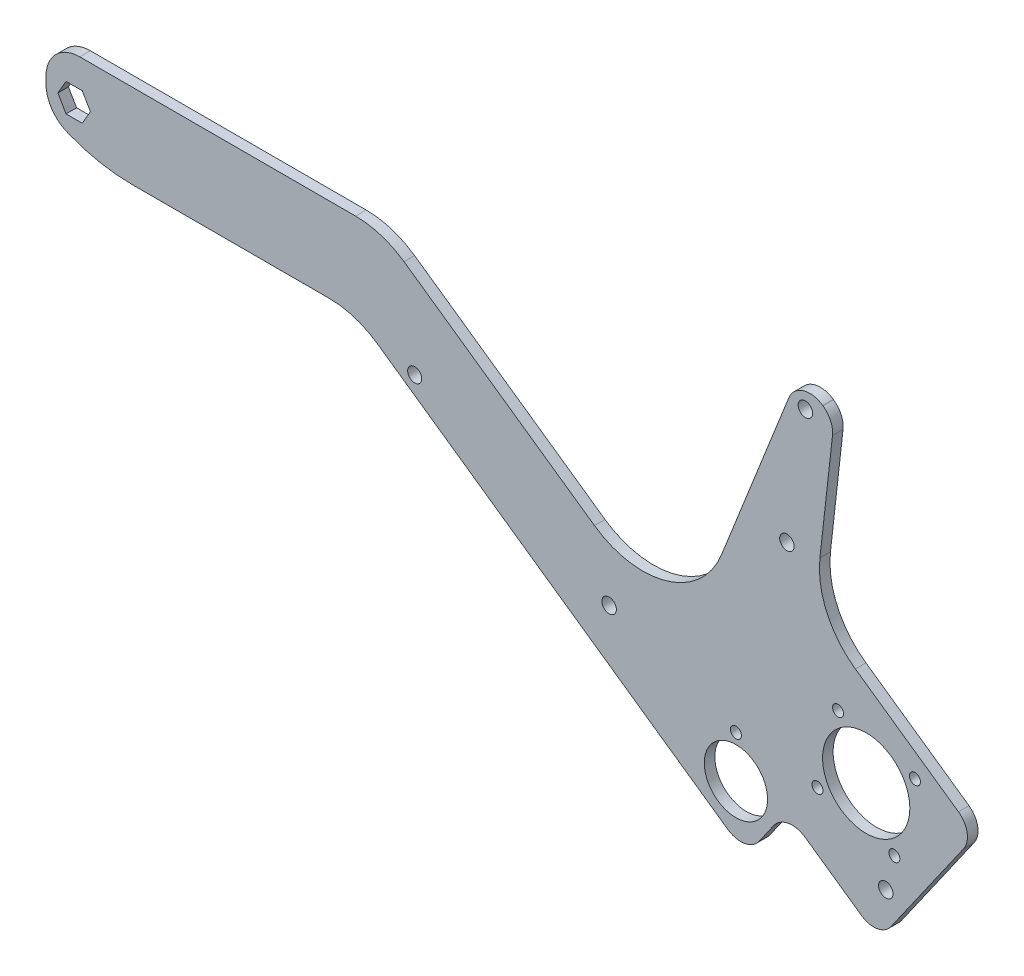
from build123d import *

# Parameters (mm, degrees)
SKETCH1_R               = 14.2875
SKETCH1_R_2             = 3.2639
SKETCH1_R_3             = 2.4892
BOSS_EXTRUDE1_DEPTH     = 4.7625
CUT_EXTRUDE1_DEPTH      = 446.923725363
CUT_EXTRUDE1_DEPTH_BACK = 446.923725363
SKETCH2_R               = 19.685
SKETCH2_R_2             = 2.4892
SKETCH2_R_3             = 3.175
FILLET3_R               = 38.1
FILLET4_R               = 10.16


with BuildPart() as part:
    # Sketch1 → Boss-Extrude1 (new body)
    with BuildSketch(Plane.XY):
        with BuildLine():
            Line((27.94, 38.1), (164.412883856, 38.1))
            Line((164.412883856, 38.1), (299.654886368, -56.597469642))
            Line((299.654886368, -56.597469642), (352.6409093, 76.843527732))
            Line((352.6409093, 76.843527732), (368.245755744, 65.91689662))
            Line((368.245755744, 65.91689662), (359.391134552, -13.154135899))
            Line((359.391134552, -13.154135899), (424.411328067, -58.681765534))
            ThreePointArc((424.411328067, -58.681765534), (428.328306358, -64.830189864), (426.750435733, -71.947504312))
            Line((426.750435733, -71.947504312), (393.970542395, -118.762043644))
            ThreePointArc((393.970542395, -118.762043644), (387.822118066, -122.679021935), (380.704803617, -121.101151309))
            Line((380.704803617, -121.101151309), (346.894302989, -97.426783899))
            Line((346.894302989, -97.426783899), (328.683251135, -123.434861305))
            Line((328.683251135, -123.434861305), (152.4, 0))
            Line((152.4, 0), (51.495079847, 0))
            ThreePointArc((51.495079847, 0), (37.452913318, 1.305023138), (23.891727162, 5.175392148))
            Line((23.891727162, 5.175392148), (22.419329463, 5.747632027))
            ThreePointArc((22.419329463, 5.747632027), (15.362388562, 11.346666629), (12.7, 19.952553597))
            Line((12.7, 19.952553597), (12.7, 22.86))
            ThreePointArc((12.7, 22.86), (17.163692655, 33.636307345), (27.94, 38.1))
        make_face()
        with Locations(Location((324.005035804, -96.903383749, 0), (0, 0, 180))):
            Circle(SKETCH1_R, mode=Mode.SUBTRACT)
        with Locations(Location((347.013016961, 7.916185169, 0), (0, 0, 180))):
            Circle(SKETCH1_R_2, mode=Mode.SUBTRACT)
        with Locations(Location((324.005035804, -77.853383749, 0), (0, 0, 180))):
            Circle(SKETCH1_R_3, mode=Mode.SUBTRACT)
        with Locations(Location((355.344238002, 64.097950502, 0), (0, 0, 180))):
            Circle(SKETCH1_R_2, mode=Mode.SUBTRACT)
        with Locations(Location((391.63143473, -105.496304865, 0), (0, 0, 180))):
            Circle(SKETCH1_R_2, mode=Mode.SUBTRACT)
        with Locations(Location((266.78726551, -56.83906967, 0), (0, 0, 180))):
            Circle(SKETCH1_R_2, mode=Mode.SUBTRACT)
        Polygon((18.067651581, 19.05), (21.733825791, 12.7), (29.066174209, 12.7), (32.732348419, 19.05), (29.066174209, 25.4), (21.733825791, 25.4), align=None, mode=Mode.SUBTRACT)
    extrude(amount=BOSS_EXTRUDE1_DEPTH)

    # Sketch2 → Cut-Extrude1 (cut, two sides: drawn at the far end of the back side and taken through both)
    with BuildSketch(Plane.XY.offset(4.7625).offset(-CUT_EXTRUDE1_DEPTH_BACK)):
        with Locations((382.793006548, -68.299896272)):
            Circle(SKETCH2_R)
        with Locations((395.493006548, -90.296941528)):
            Circle(SKETCH2_R_2)
        with Locations((360.795961291, -80.999896272)):
            Circle(SKETCH2_R_2)
        with Locations((370.093006548, -46.302851016)):
            Circle(SKETCH2_R_2)
        with Locations((404.790051804, -55.599896272)):
            Circle(SKETCH2_R_2)
        with Locations((179.07, -10.598705626)):
            Circle(SKETCH2_R_3)
    extrude(amount=CUT_EXTRUDE1_DEPTH + CUT_EXTRUDE1_DEPTH_BACK, mode=Mode.SUBTRACT)

    # Fillet3
    fillet3_edges = [part.edges().sort_by_distance(p)[0] for p in [
        (164.412883856, 38.1, 2.38125),
        (299.654886368, -56.597469642, 2.38125),
        (359.391134552, -13.154135899, 2.38125),
        (152.4, 0, 2.38125),
    ]]
    fillet(fillet3_edges, radius=FILLET3_R)

    # Fillet4
    fillet4_edges = [part.edges().sort_by_distance(p)[0] for p in [
        (352.6409093, 76.843527732, 2.38125),
        (368.245755744, 65.91689662, 2.38125),
        (346.894302989, -97.426783899, 2.38125),
        (328.683251135, -123.434861305, 2.38125),
    ]]
    fillet(fillet4_edges, radius=FILLET4_R)


solid = part.part
